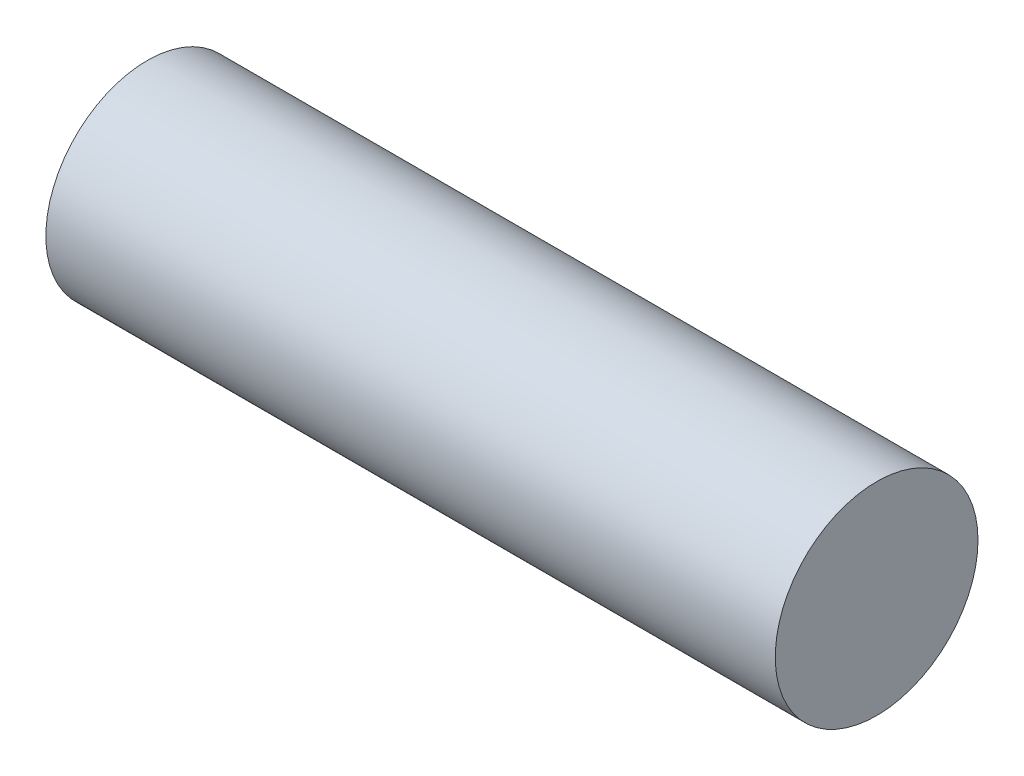
from build123d import *

# Parameters (mm, degrees)
SKETCH1_R           = 2.0828
BOSS_EXTRUDE1_DEPTH = 14.986


with BuildPart() as part:
    # Sketch1 → Boss-Extrude1 (new body)
    with BuildSketch(Plane(origin=(0, 0, 0), x_dir=(0, 0, -1), z_dir=(1, 0, 0))):
        Circle(SKETCH1_R)
    extrude(amount=BOSS_EXTRUDE1_DEPTH)


solid = part.part
